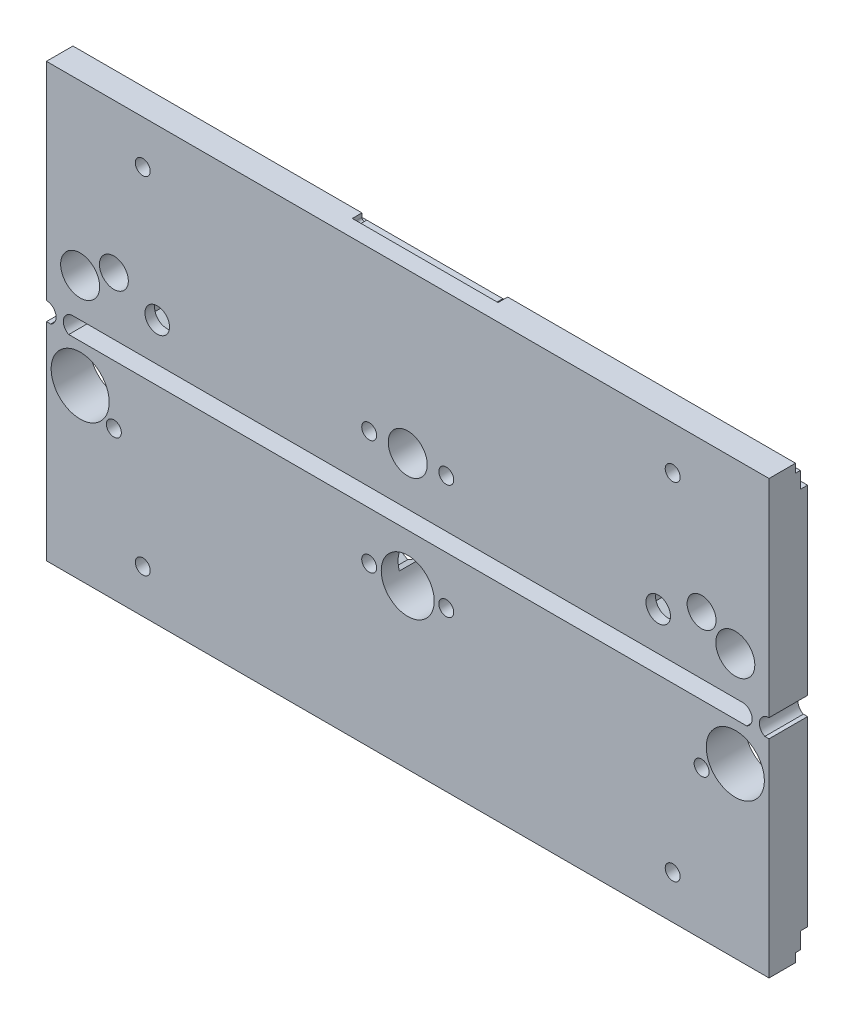
from build123d import *

# Parameters (mm, degrees)
SKETCH_2_W           = 150
SKETCH_2_H           = 43
SKETCH_2_R           = 4.05
EXTRUDE_1_DEPTH      = 8
SKETCH_3_R           = 2.55
CUT_EXTRUDE_1_DEPTH  = 157.246599963
CUT_EXTRUDE_2_DEPTH  = 157.246599963
SKETCH_5_R           = 1.55
CUT_EXTRUDE_3_DEPTH  = 157.246599963
CUT_EXTRUDE_5_DEPTH  = 4.5
SKETCH_25_R          = 1.55
CUT_EXTRUDE_13_DEPTH = 157.246599963
CUT_EXTRUDE_11_DEPTH = 2
EXTRUDE_2_DEPTH      = 8
SKETCH_26_R          = 6.025
CUT_EXTRUDE_14_DEPTH = 158.334802253
SKETCH_27_R          = 3
SKETCH_27_R_2        = 1.55
CUT_EXTRUDE_15_DEPTH = 158.334802253
CUT_EXTRUDE_16_DEPTH = 6
SKETCH_29_R          = 5.5
CUT_EXTRUDE_17_DEPTH = 158.334802253


with BuildPart() as part:
    # 草图2 → 凸台-拉伸1 (new body)
    with BuildSketch(Plane.XY):
        with Locations((75, 21.5)):
            Rectangle(SKETCH_2_W, SKETCH_2_H)
        with Locations((7, 8)):
            Circle(SKETCH_2_R, mode=Mode.SUBTRACT)
        with Locations((75, 10)):
            Circle(SKETCH_2_R, mode=Mode.SUBTRACT)
        with Locations((143, 8)):
            Circle(SKETCH_2_R, mode=Mode.SUBTRACT)
    extrude_1 = extrude(amount=EXTRUDE_1_DEPTH)

    # 草图3 → 切除-拉伸1 (cut, through all)
    with BuildSketch(Plane.XY.offset(8)):
        with Locations((23, 8)):
            Circle(SKETCH_3_R)
        with Locations((127, 8)):
            Circle(SKETCH_3_R)
    extrude(amount=-CUT_EXTRUDE_1_DEPTH, mode=Mode.SUBTRACT)

    # 草图4 → 切除-拉伸2 (cut, through all)
    with BuildSketch(Plane(origin=(150, 0, 0), x_dir=(0, 0, -1), z_dir=(1, 0, 0))):
        Polygon((-1.5, 41.2), (-2.5, 41.2), (-2.5, 43), (0, 43), (0, 37.8), (-1.5, 37.8), align=None)
    cut_extrude_2 = extrude(amount=-CUT_EXTRUDE_2_DEPTH, mode=Mode.SUBTRACT)

    # 草图5 → 切除-拉伸3 (cut, through all)
    with BuildSketch(Plane.XY.offset(8)):
        with Locations((83, 10)):
            Circle(SKETCH_5_R)
        with Locations((67, 10)):
            Circle(SKETCH_5_R)
    cut_extrude_3 = extrude(amount=-CUT_EXTRUDE_3_DEPTH, mode=Mode.SUBTRACT)

    # 草图8 → 切除-拉伸5 (cut)
    with BuildSketch(Plane(origin=(0, 0, 0), x_dir=(-1, 0, 0), z_dir=(0, 0, -1))):
        Polygon((-80.15, 8.354551733), (-80.15, 11.645448267), (-83, 13.290896534), (-85.85, 11.645448267), (-85.85, 8.354551733), (-83, 6.709103466), align=None)
        Polygon((-64.15, 8.354551733), (-64.15, 11.645448267), (-67, 13.290896534), (-69.85, 11.645448267), (-69.85, 8.354551733), (-67, 6.709103466), align=None)
    cut_extrude_5 = extrude(amount=-CUT_EXTRUDE_5_DEPTH, mode=Mode.SUBTRACT)

    # 草图25 → 切除-拉伸13 (cut, through all)
    with BuildSketch(Plane(origin=(0, 0, 0), x_dir=(-1, 0, 0), z_dir=(0, 0, -1))):
        with Locations((-130, 34)):
            Circle(SKETCH_25_R)
        with Locations((-20, 34)):
            Circle(SKETCH_25_R)
    cut_extrude_13 = extrude(amount=-CUT_EXTRUDE_13_DEPTH, mode=Mode.SUBTRACT)

    # 草图19 → 切除-拉伸11 (cut)
    with BuildSketch(Plane(origin=(0, 0, 2.5), x_dir=(-1, 0, 0), z_dir=(0, 0, -1))):
        with BuildLine():
            Line((-60, 43), (-90.247938178, 43))
            Line((-90.247938178, 43), (-90.247938178, 42.2))
            ThreePointArc((-90.247938178, 42.2), (-89.747938178, 41.7), (-89.247938178, 42.2))
            Line((-89.247938178, 42.2), (-61, 42.2))
            ThreePointArc((-61, 42.2), (-60.5, 41.7), (-60, 42.2))
            Line((-60, 42.2), (-60, 43))
        make_face()
    cut_extrude_11 = extrude(amount=-CUT_EXTRUDE_11_DEPTH, mode=Mode.SUBTRACT)

    # 草图22 → 凸台-拉伸2 (add)
    with BuildSketch(Plane.XY.offset(8)):
        with BuildLine():
            Line((0, -4), (5.5, -4))
            ThreePointArc((5.5, -4), (3.5, -2), (5.5, 0))
            Line((5.5, 0), (0, 0))
            ThreePointArc((0, 0), (2, -2), (0, -4))
        make_face()
        with BuildLine():
            Line((150, 0), (144.5, 0))
            ThreePointArc((144.5, 0), (146.5, -2), (144.5, -4))
            Line((144.5, -4), (150, -4))
            ThreePointArc((150, -4), (148, -2), (150, 0))
        make_face()
    extrude(amount=-EXTRUDE_2_DEPTH)

    # 镜向2: 凸台-拉伸1, 切除-拉伸2, 切除-拉伸3, 切除-拉伸5, 切除-拉伸13, 切除-拉伸11 across plane
    add(extrude_1.mirror(Plane(origin=(0, -1.9, 0), x_dir=(0, 0, 1), z_dir=(0, -1, 0))))
    add(cut_extrude_2.mirror(Plane(origin=(0, -1.9, 0), x_dir=(0, 0, 1), z_dir=(0, -1, 0))), mode=Mode.SUBTRACT)
    add(cut_extrude_3.mirror(Plane(origin=(0, -1.9, 0), x_dir=(0, 0, 1), z_dir=(0, -1, 0))), mode=Mode.SUBTRACT)
    add(cut_extrude_5.mirror(Plane(origin=(0, -1.9, 0), x_dir=(0, 0, 1), z_dir=(0, -1, 0))), mode=Mode.SUBTRACT)
    add(cut_extrude_13.mirror(Plane(origin=(0, -1.9, 0), x_dir=(0, 0, 1), z_dir=(0, -1, 0))), mode=Mode.SUBTRACT)
    add(cut_extrude_11.mirror(Plane(origin=(0, -1.9, 0), x_dir=(0, 0, 1), z_dir=(0, -1, 0))), mode=Mode.SUBTRACT)

    # 草图26 → 切除-拉伸14 (cut, through all)
    with BuildSketch(Plane(origin=(0, 0, 0), x_dir=(-1, 0, 0), z_dir=(0, 0, -1))):
        with Locations((-143, -11.8)):
            Circle(SKETCH_26_R)
        with Locations((-7, -11.8)):
            Circle(SKETCH_26_R)
    extrude(amount=-CUT_EXTRUDE_14_DEPTH, mode=Mode.SUBTRACT)

    # 草图27 → 切除-拉伸15 (cut, through all)
    with BuildSketch(Plane(origin=(0, 0, 0), x_dir=(-1, 0, 0), z_dir=(0, 0, -1))):
        with Locations((-136, 12)):
            Circle(SKETCH_27_R)
        with Locations((-136, -16)):
            Circle(SKETCH_27_R_2)
        with Locations((-14, -16)):
            Circle(SKETCH_27_R_2)
        with Locations((-14, 12)):
            Circle(SKETCH_27_R)
    extrude(amount=-CUT_EXTRUDE_15_DEPTH, mode=Mode.SUBTRACT)

    # 草图28 → 切除-拉伸16 (cut)
    with BuildSketch(Plane(origin=(0, 0, 0), x_dir=(-1, 0, 0), z_dir=(0, 0, -1))):
        Polygon((-122.9, 5.632863896), (-122.9, 10.367136104), (-127, 12.734272207), (-131.1, 10.367136104), (-131.1, 5.632863896), (-127, 3.265727793), align=None)
        Polygon((-18.9, 5.632863896), (-18.9, 10.367136104), (-23, 12.734272207), (-27.1, 10.367136104), (-27.1, 5.632863896), (-23, 3.265727793), align=None)
    extrude(amount=-CUT_EXTRUDE_16_DEPTH, mode=Mode.SUBTRACT)

    # 草图29 → 切除-拉伸17 (cut, through all)
    with BuildSketch(Plane(origin=(0, 0, 0), x_dir=(-1, 0, 0), z_dir=(0, 0, -1))):
        with Locations((-75, -13.8)):
            Circle(SKETCH_29_R)
    extrude(amount=-CUT_EXTRUDE_17_DEPTH, mode=Mode.SUBTRACT)


solid = part.part
